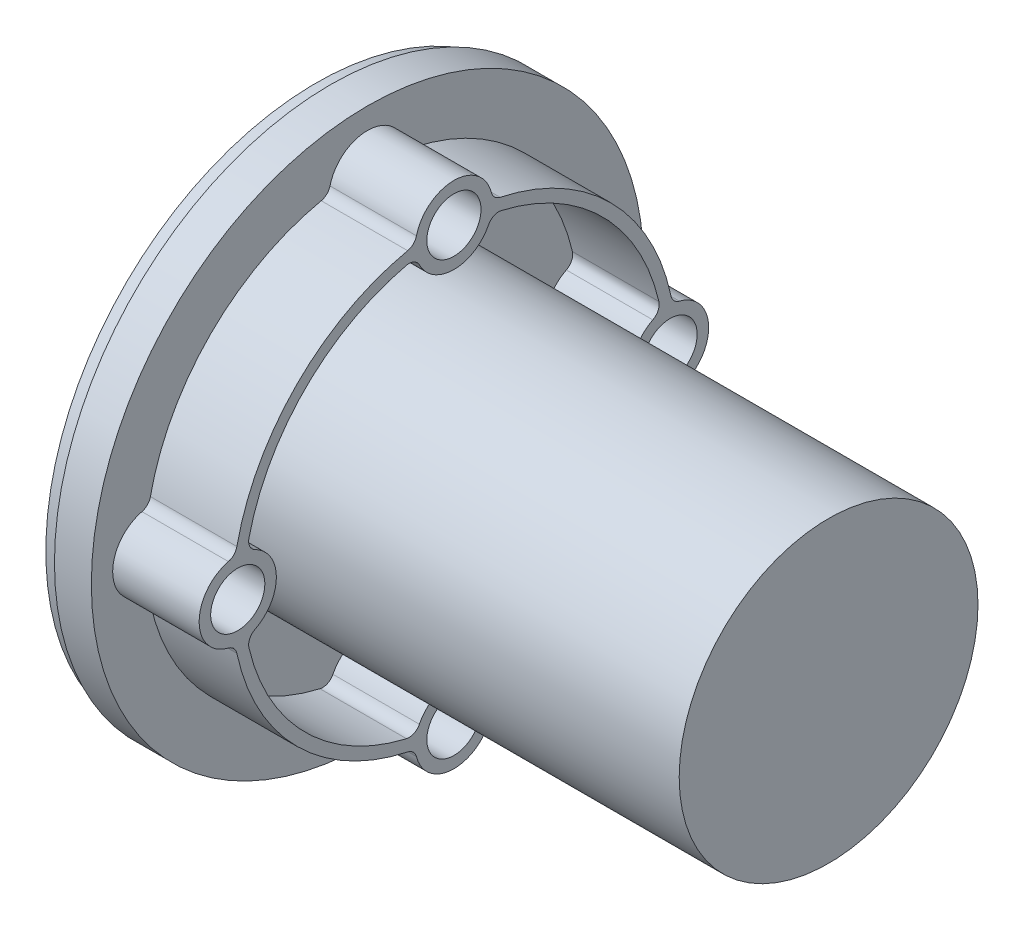
from build123d import *
from build123d.topology import SkipClean

# Parameters (mm, degrees)
SKETCH1_R           = 28.8925
SKETCH1_R_2         = 25.0825
EXTRUDE_THIN1_DEPTH = 21.59
SKETCH2_R           = 59.563
BOSS_EXTRUDE1_DEPTH = 3.175
CUT_EXTRUDE1_DEPTH  = 87.224208683
SKETCH4_R           = 60.833
BOSS_EXTRUDE2_DEPTH = 8.128
SKETCH5_R           = 25.0825
CUT_EXTRUDE2_DEPTH  = 88.979656757
BOSS_EXTRUDE4_DEPTH = 19.05
FILLET1_R           = 2.54
SKETCH7_R           = 32.9184
BOSS_EXTRUDE5_DEPTH = 101.6
SKETCH8_R           = 10.795
BOSS_EXTRUDE6_DEPTH = 29.718
CHAMFER1_SIZE       = 1.27


with BuildPart() as part:
    # Sketch1 → Extrude-Thin1 (new body)
    with BuildSketch(Plane(origin=(0, 0, 0), x_dir=(0, 0, -1), z_dir=(1, 0, 0))):
        Circle(SKETCH1_R)
        Circle(SKETCH1_R_2, mode=Mode.SUBTRACT)
    extrude(amount=EXTRUDE_THIN1_DEPTH)



with BuildPart() as body_2:
    # Sketch2 → Boss-Extrude1 (new body)
    with BuildSketch(Plane(origin=(21.59, 0, 0), x_dir=(0, 0, -1), z_dir=(1, 0, 0))):
        Circle(SKETCH2_R)
    extrude(amount=-BOSS_EXTRUDE1_DEPTH)

    # Sketch3 → Cut-Extrude1 (cut, through all)
    with BuildSketch(Plane.ZY.offset(-18.415)):
        with BuildLine():
            Line((35.687, 5.969), (47.625, 5.969))
            ThreePointArc((47.625, 5.969), (53.594, 0), (47.625, -5.969))
            Line((47.625, -5.969), (35.687, -5.969))
            ThreePointArc((35.687, -5.969), (29.718, 0), (35.687, 5.969))
        make_face()
        with BuildLine():
            Line((-5.969, -35.687), (-5.969, -47.625))
            ThreePointArc((-5.969, -47.625), (0, -53.594), (5.969, -47.625))
            Line((5.969, -47.625), (5.969, -35.687))
            ThreePointArc((5.969, -35.687), (0, -29.718), (-5.969, -35.687))
        make_face()
        with BuildLine():
            Line((-35.687, 5.969), (-47.625, 5.969))
            ThreePointArc((-47.625, 5.969), (-53.594, 0), (-47.625, -5.969))
            Line((-47.625, -5.969), (-35.687, -5.969))
            ThreePointArc((-35.687, -5.969), (-29.718, 0), (-35.687, 5.969))
        make_face()
        with BuildLine():
            Line((5.969, 35.687), (5.969, 47.625))
            ThreePointArc((5.969, 47.625), (0, 53.594), (-5.969, 47.625))
            Line((-5.969, 47.625), (-5.969, 35.687))
            ThreePointArc((-5.969, 35.687), (0, 29.718), (5.969, 35.687))
        make_face()
    extrude(amount=-CUT_EXTRUDE1_DEPTH, mode=Mode.SUBTRACT)


with BuildPart() as body_3:
    # Sketch4 → Boss-Extrude2 (new body)
    with BuildSketch(Plane(origin=(21.59, 0, 0), x_dir=(0, 0, -1), z_dir=(1, 0, 0))):
        Circle(SKETCH4_R)
    extrude(amount=BOSS_EXTRUDE2_DEPTH)


with BuildPart() as cut_extrude2_tool:
    # Sketch5 → Cut-Extrude2 (new, through all)
    with BuildSketch(Plane.ZY.offset(-18.415)):
        with BuildLine():
            ThreePointArc((-41.656, 0), (-43.404279623, 4.220720377), (-47.625, 5.969))
            ThreePointArc((-47.625, 5.969), (-53.594, 0), (-47.625, -5.969))
            ThreePointArc((-47.625, -5.969), (-43.404279623, -4.220720377), (-41.656, 0))
        make_face()
        with BuildLine():
            ThreePointArc((-5.969, 47.625), (0, 41.656), (5.969, 47.625))
            ThreePointArc((5.969, 47.625), (0, 53.594), (-5.969, 47.625))
        make_face()
        with BuildLine():
            ThreePointArc((47.625, 5.969), (41.656, 0), (47.625, -5.969))
            ThreePointArc((47.625, -5.969), (51.845720377, -4.220720377), (53.594, 0))
            ThreePointArc((53.594, 0), (51.845720377, 4.220720377), (47.625, 5.969))
        make_face()
        with BuildLine():
            ThreePointArc((5.969, -47.625), (0, -41.656), (-5.969, -47.625))
            ThreePointArc((-5.969, -47.625), (0, -53.594), (5.969, -47.625))
        make_face()
        with Locations(Location((0, 0, 0), (0, 0, 180))):
            Circle(SKETCH5_R)
    extrude(amount=-CUT_EXTRUDE2_DEPTH)


with BuildPart() as body_2_1:
    add(body_2.part)

    # Cut-Extrude2: cut by cut_extrude2_tool
    add(cut_extrude2_tool.part, mode=Mode.SUBTRACT)


with BuildPart() as body_3_1:
    add(body_3.part)

    # Cut-Extrude2: cut by cut_extrude2_tool
    add(cut_extrude2_tool.part, mode=Mode.SUBTRACT)



with BuildPart() as body_4:
    # Sketch6 → Boss-Extrude4 (new body)
    with BuildSketch(Plane(origin=(29.718, 0, 0), x_dir=(0, 0, -1), z_dir=(1, 0, 0))):
        with BuildLine():
            ThreePointArc((-45.997876, 5.742945976), (-42.863631281, 3.599767898), (-41.656, 0))
            ThreePointArc((-41.656, 0), (-42.863631281, -3.599767898), (-45.997876, -5.742945976))
            ThreePointArc((-45.997876, -5.742945976), (-45.822224219, -7.007837943), (-45.611796, -8.267411364))
            ThreePointArc((-45.611796, -8.267411364), (-40.934206555, -5.257029968), (-39.116, 0))
            ThreePointArc((-39.116, 0), (-40.934206555, 5.257029968), (-45.611796, 8.267411364))
            ThreePointArc((-45.611796, 8.267411364), (-45.822224219, 7.007837943), (-45.997876, 5.742945976))
        make_face()
        with BuildLine():
            ThreePointArc((-48.537876, -5.898781095), (-53.594, 0), (-48.537876, 5.898781095))
            ThreePointArc((-48.537876, 5.898781095), (-48.3622295, 7.198318054), (-48.151796, 8.492677256))
            ThreePointArc((-48.151796, 8.492677256), (-56.134, 0), (-48.151796, -8.492677256))
            ThreePointArc((-48.151796, -8.492677256), (-48.3622295, -7.198318054), (-48.537876, -5.898781095))
        make_face()
        with BuildLine():
            ThreePointArc((-48.537876, 5.898781095), (-47.259474765, 5.957797605), (-45.997876, 5.742945976))
            ThreePointArc((-45.997876, 5.742945976), (-45.822224219, 7.007837943), (-45.611796, 8.267411364))
            ThreePointArc((-45.611796, 8.267411364), (-46.873309661, 8.475732572), (-48.151796, 8.492677256))
            ThreePointArc((-48.151796, 8.492677256), (-48.3622295, 7.198318054), (-48.537876, 5.898781095))
        make_face()
        with BuildLine():
            ThreePointArc((-48.151796, 8.492677256), (-46.873309661, 8.475732572), (-45.611796, 8.267411364))
            ThreePointArc((-45.611796, 8.267411364), (-32.777934842, 32.777934842), (-8.267411364, 45.611796))
            ThreePointArc((-8.267411364, 45.611796), (-8.475732572, 46.873309661), (-8.492677256, 48.151796))
            ThreePointArc((-8.492677256, 48.151796), (-34.573986066, 34.573986066), (-48.151796, 8.492677256))
        make_face()
        with BuildLine():
            ThreePointArc((-45.611796, -8.267411364), (-45.822224219, -7.007837943), (-45.997876, -5.742945976))
            ThreePointArc((-45.997876, -5.742945976), (-47.259474765, -5.957797605), (-48.537876, -5.898781095))
            ThreePointArc((-48.537876, -5.898781095), (-48.3622295, -7.198318054), (-48.151796, -8.492677256))
            ThreePointArc((-48.151796, -8.492677256), (-46.873309661, -8.475732572), (-45.611796, -8.267411364))
        make_face()
        with BuildLine():
            ThreePointArc((-8.267411364, -45.611796), (-32.777934842, -32.777934842), (-45.611796, -8.267411364))
            ThreePointArc((-45.611796, -8.267411364), (-46.873309661, -8.475732572), (-48.151796, -8.492677256))
            ThreePointArc((-48.151796, -8.492677256), (-34.573986066, -34.573986066), (-8.492677256, -48.151796))
            ThreePointArc((-8.492677256, -48.151796), (-8.475732572, -46.873309661), (-8.267411364, -45.611796))
        make_face()
        with BuildLine():
            ThreePointArc((-8.492677256, 48.151796), (-8.475732572, 46.873309661), (-8.267411364, 45.611796))
            ThreePointArc((-8.267411364, 45.611796), (-7.007837943, 45.822224219), (-5.742945976, 45.997876))
            ThreePointArc((-5.742945976, 45.997876), (-5.957797605, 47.259474765), (-5.898781095, 48.537876))
            ThreePointArc((-5.898781095, 48.537876), (-7.198318054, 48.3622295), (-8.492677256, 48.151796))
        make_face()
        with BuildLine():
            ThreePointArc((8.492677256, 48.151796), (0, 56.134), (-8.492677256, 48.151796))
            ThreePointArc((-8.492677256, 48.151796), (-7.198318054, 48.3622295), (-5.898781095, 48.537876))
            ThreePointArc((-5.898781095, 48.537876), (0, 53.594), (5.898781095, 48.537876))
            ThreePointArc((5.898781095, 48.537876), (7.198318054, 48.3622295), (8.492677256, 48.151796))
        make_face()
        with BuildLine():
            ThreePointArc((-5.742945976, 45.997876), (-7.007837943, 45.822224219), (-8.267411364, 45.611796))
            ThreePointArc((-8.267411364, 45.611796), (0, 39.116), (8.267411364, 45.611796))
            ThreePointArc((8.267411364, 45.611796), (7.007837943, 45.822224219), (5.742945976, 45.997876))
            ThreePointArc((5.742945976, 45.997876), (0, 41.656), (-5.742945976, 45.997876))
        make_face()
        with BuildLine():
            ThreePointArc((5.742945976, 45.997876), (7.007837943, 45.822224219), (8.267411364, 45.611796))
            ThreePointArc((8.267411364, 45.611796), (8.448386955, 46.611176123), (8.509, 47.625))
            ThreePointArc((8.509, 47.625), (8.504918335, 47.888524409), (8.492677256, 48.151796))
            ThreePointArc((8.492677256, 48.151796), (7.198318054, 48.3622295), (5.898781095, 48.537876))
            ThreePointArc((5.898781095, 48.537876), (5.951419384, 48.082786327), (5.969, 47.625))
            ThreePointArc((5.969, 47.625), (5.912216401, 46.803624183), (5.742945976, 45.997876))
        make_face()
        with BuildLine():
            ThreePointArc((8.509, 47.625), (8.448386955, 46.611176123), (8.267411364, 45.611796))
            ThreePointArc((8.267411364, 45.611796), (32.777934842, 32.777934842), (45.611796, 8.267411364))
            ThreePointArc((45.611796, 8.267411364), (46.873309661, 8.475732572), (48.151796, 8.492677256))
            ThreePointArc((48.151796, 8.492677256), (34.573986066, 34.573986066), (8.492677256, 48.151796))
            ThreePointArc((8.492677256, 48.151796), (8.504918335, 47.888524409), (8.509, 47.625))
        make_face()
        with BuildLine():
            ThreePointArc((48.151796, 8.492677256), (46.873309661, 8.475732572), (45.611796, 8.267411364))
            ThreePointArc((45.611796, 8.267411364), (45.822224219, 7.007837943), (45.997876, 5.742945976))
            ThreePointArc((45.997876, 5.742945976), (47.259474765, 5.957797605), (48.537876, 5.898781095))
            ThreePointArc((48.537876, 5.898781095), (48.3622295, 7.198318054), (48.151796, 8.492677256))
        make_face()
        with BuildLine():
            ThreePointArc((45.997876, 5.742945976), (45.822224219, 7.007837943), (45.611796, 8.267411364))
            ThreePointArc((45.611796, 8.267411364), (39.116, 0), (45.611796, -8.267411364))
            ThreePointArc((45.611796, -8.267411364), (45.822224219, -7.007837943), (45.997876, -5.742945976))
            ThreePointArc((45.997876, -5.742945976), (41.656, 0), (45.997876, 5.742945976))
        make_face()
        with BuildLine():
            ThreePointArc((56.134, 0), (53.825225325, 5.827545531), (48.151796, 8.492677256))
            ThreePointArc((48.151796, 8.492677256), (48.3622295, 7.198318054), (48.537876, 5.898781095))
            ThreePointArc((48.537876, 5.898781095), (52.15699282, 3.884585187), (53.594, 0))
            ThreePointArc((53.594, 0), (52.15699282, -3.884585187), (48.537876, -5.898781095))
            ThreePointArc((48.537876, -5.898781095), (48.3622295, -7.198318054), (48.151796, -8.492677256))
            ThreePointArc((48.151796, -8.492677256), (53.825225325, -5.827545531), (56.134, 0))
        make_face()
        with BuildLine():
            ThreePointArc((45.997876, -5.742945976), (45.822224219, -7.007837943), (45.611796, -8.267411364))
            ThreePointArc((45.611796, -8.267411364), (46.873309661, -8.475732572), (48.151796, -8.492677256))
            ThreePointArc((48.151796, -8.492677256), (48.3622295, -7.198318054), (48.537876, -5.898781095))
            ThreePointArc((48.537876, -5.898781095), (47.259474765, -5.957797605), (45.997876, -5.742945976))
        make_face()
        with BuildLine():
            ThreePointArc((45.611796, -8.267411364), (32.777934842, -32.777934842), (8.267411364, -45.611796))
            ThreePointArc((8.267411364, -45.611796), (8.448386955, -46.611176123), (8.509, -47.625))
            ThreePointArc((8.509, -47.625), (8.504918335, -47.888524409), (8.492677256, -48.151796))
            ThreePointArc((8.492677256, -48.151796), (34.573986066, -34.573986066), (48.151796, -8.492677256))
            ThreePointArc((48.151796, -8.492677256), (46.873309661, -8.475732572), (45.611796, -8.267411364))
        make_face()
        with BuildLine():
            ThreePointArc((8.267411364, -45.611796), (0, -39.116), (-8.267411364, -45.611796))
            ThreePointArc((-8.267411364, -45.611796), (-7.007837943, -45.822224219), (-5.742945976, -45.997876))
            ThreePointArc((-5.742945976, -45.997876), (0, -41.656), (5.742945976, -45.997876))
            ThreePointArc((5.742945976, -45.997876), (7.007837943, -45.822224219), (8.267411364, -45.611796))
        make_face()
        with BuildLine():
            ThreePointArc((-5.742945976, -45.997876), (-7.007837943, -45.822224219), (-8.267411364, -45.611796))
            ThreePointArc((-8.267411364, -45.611796), (-8.475732572, -46.873309661), (-8.492677256, -48.151796))
            ThreePointArc((-8.492677256, -48.151796), (-7.198318054, -48.3622295), (-5.898781095, -48.537876))
            ThreePointArc((-5.898781095, -48.537876), (-5.957797605, -47.259474765), (-5.742945976, -45.997876))
        make_face()
        with BuildLine():
            ThreePointArc((-5.898781095, -48.537876), (-7.198318054, -48.3622295), (-8.492677256, -48.151796))
            ThreePointArc((-8.492677256, -48.151796), (0, -56.134), (8.492677256, -48.151796))
            ThreePointArc((8.492677256, -48.151796), (7.198318054, -48.3622295), (5.898781095, -48.537876))
            ThreePointArc((5.898781095, -48.537876), (0, -53.594), (-5.898781095, -48.537876))
        make_face()
        with BuildLine():
            ThreePointArc((8.509, -47.625), (8.448386955, -46.611176123), (8.267411364, -45.611796))
            ThreePointArc((8.267411364, -45.611796), (7.007837943, -45.822224219), (5.742945976, -45.997876))
            ThreePointArc((5.742945976, -45.997876), (5.912216401, -46.803624183), (5.969, -47.625))
            ThreePointArc((5.969, -47.625), (5.951419384, -48.082786327), (5.898781095, -48.537876))
            ThreePointArc((5.898781095, -48.537876), (7.198318054, -48.3622295), (8.492677256, -48.151796))
            ThreePointArc((8.492677256, -48.151796), (8.504918335, -47.888524409), (8.509, -47.625))
        make_face()
    extrude(amount=BOSS_EXTRUDE4_DEPTH)

    # Fillet1
    fillet1_edges = [body_4.edges().sort_by_distance(p)[0] for p in [
        (39.243, -48.151796, -8.492677256),
        (39.243, -48.151796, 8.492677256),
        (39.243, -8.492677256, 48.151796),
        (39.243, 8.492677256, 48.151796),
        (39.243, 48.151796, 8.492677256),
        (39.243, 48.151796, -8.492677256),
        (39.243, 8.492677256, -48.151796),
        (39.243, -8.492677256, -48.151796),
        (39.243, 8.267411364, -45.611796),
        (39.243, 45.611796, -8.267411364),
        (39.243, 45.611796, 8.267411364),
        (39.243, 8.267411364, 45.611796),
        (39.243, -8.267411364, 45.611796),
        (39.243, -45.611796, 8.267411364),
        (39.243, -45.611796, -8.267411364),
        (39.243, -8.267411364, -45.611796),
    ]]
    fillet(fillet1_edges, radius=FILLET1_R)


with BuildPart() as body_3_2:
    add(body_3_1.part)

    add(body_4.part)  # Boss-Extrude5 merges body 4
    # Sketch7 → Boss-Extrude5 (add)
    with BuildSketch(Plane(origin=(29.718, 0, 0), x_dir=(0, 0, -1), z_dir=(1, 0, 0))):
        Circle(SKETCH7_R)
    extrude(amount=BOSS_EXTRUDE5_DEPTH)


with BuildPart() as part_1:
    with SkipClean():  # the faces are left unmerged after this step: merging them gives an invalid solid
        add(part.part)

        add(body_2_1.part)  # Boss-Extrude6 merges body 2

        add(body_3_2.part)  # Boss-Extrude6 merges body 3
        # Sketch8 → Boss-Extrude6 (add)
        with BuildSketch(Plane.ZY.offset(-29.718)):
            with Locations(Location((0, 0, 0), (0, 0, 180))):
                Circle(SKETCH8_R)
        extrude(amount=BOSS_EXTRUDE6_DEPTH)

    # Chamfer1
    chamfer1_edges = [part_1.edges().sort_by_distance(p)[0] for p in [
        (0, 0, 10.795),
        (0, 0, 28.8925),
    ]]
    chamfer(chamfer1_edges, length=CHAMFER1_SIZE)


solid = part_1.part
